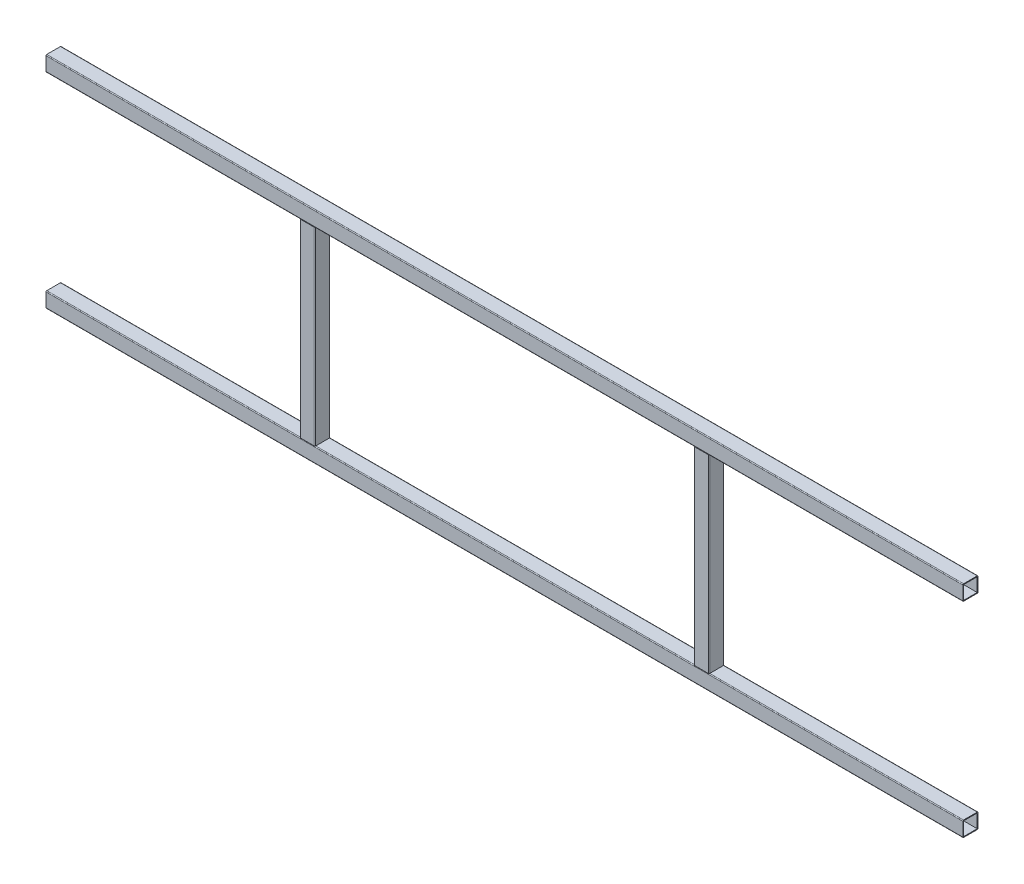
from build123d import *

# Parameters (mm, degrees)
F_8639_82_80_X_80_X_4_0_1_DEPTH   = 4840
F_8639_82_80_X_80_X_4_0_1_2_DEPTH = 4840
F_8639_82_80_X_80_X_4_0_1_3_DEPTH = 1082
F_8639_82_80_X_80_X_4_0_1_4_DEPTH = 1082


with BuildPart() as part:
    # Sketch1 → Квадратная труба гост 8639-82 _80 X 80 X 4.0(1) (new body)
    with BuildSketch(Plane.YZ):
        with BuildLine():
            Line((-35.999, -40), (35.999, -40))
            ThreePointArc((35.999, -40), (38.828134232, -38.828134232), (40, -35.999))
            Line((40, -35.999), (40, 35.999))
            ThreePointArc((40, 35.999), (38.828134232, 38.828134232), (35.999, 40))
            Line((35.999, 40), (-35.999, 40))
            ThreePointArc((-35.999, 40), (-38.828134232, 38.828134232), (-40, 35.999))
            Line((-40, 35.999), (-40, -35.999))
            ThreePointArc((-40, -35.999), (-38.828134232, -38.828134232), (-35.999, -40))
        make_face()
        with BuildLine():
            Line((-35.999, -36), (35.999, -36))
            ThreePointArc((35.999, -36), (35.999707107, -35.999707107), (36, -35.999))
            Line((36, -35.999), (36, 35.999))
            ThreePointArc((36, 35.999), (35.999707107, 35.999707107), (35.999, 36))
            Line((35.999, 36), (-35.999, 36))
            ThreePointArc((-35.999, 36), (-35.999707107, 35.999707107), (-36, 35.999))
            Line((-36, 35.999), (-36, -35.999))
            ThreePointArc((-36, -35.999), (-35.999707107, -35.999707107), (-35.999, -36))
        make_face(mode=Mode.SUBTRACT)
    extrude(amount=F_8639_82_80_X_80_X_4_0_1_DEPTH)


with BuildPart() as body_2:
    # Sketch1 on segment 2 (carried to segment 2) → 8639-82 _80 X 80 X 4.0_1 2 (new body)
    with BuildSketch(Plane(origin=(0, -1080, 0), x_dir=(0, 1, 0), z_dir=(1, 0, 0))):
        with BuildLine():
            Line((-35.999, -40), (35.999, -40))
            ThreePointArc((35.999, -40), (38.828134232, -38.828134232), (40, -35.999))
            Line((40, -35.999), (40, 35.999))
            ThreePointArc((40, 35.999), (38.828134232, 38.828134232), (35.999, 40))
            Line((35.999, 40), (-35.999, 40))
            ThreePointArc((-35.999, 40), (-38.828134232, 38.828134232), (-40, 35.999))
            Line((-40, 35.999), (-40, -35.999))
            ThreePointArc((-40, -35.999), (-38.828134232, -38.828134232), (-35.999, -40))
        make_face()
        with BuildLine():
            Line((-35.999, -36), (35.999, -36))
            ThreePointArc((35.999, -36), (35.999707107, -35.999707107), (36, -35.999))
            Line((36, -35.999), (36, 35.999))
            ThreePointArc((36, 35.999), (35.999707107, 35.999707107), (35.999, 36))
            Line((35.999, 36), (-35.999, 36))
            ThreePointArc((-35.999, 36), (-35.999707107, 35.999707107), (-36, 35.999))
            Line((-36, 35.999), (-36, -35.999))
            ThreePointArc((-36, -35.999), (-35.999707107, -35.999707107), (-35.999, -36))
        make_face(mode=Mode.SUBTRACT)
    extrude(amount=F_8639_82_80_X_80_X_4_0_1_2_DEPTH)


with BuildPart() as body_3:
    # Sketch1 on segment 3 (carried to segment 3) → 8639-82 _80 X 80 X 4.0_1 3 (new body)
    with BuildSketch(Plane(origin=(1380, 1, 0), x_dir=(1, 0, 0), z_dir=(0, -1, 0))):
        with BuildLine():
            Line((-35.999, -40), (35.999, -40))
            ThreePointArc((35.999, -40), (38.828134232, -38.828134232), (40, -35.999))
            Line((40, -35.999), (40, 35.999))
            ThreePointArc((40, 35.999), (38.828134232, 38.828134232), (35.999, 40))
            Line((35.999, 40), (-35.999, 40))
            ThreePointArc((-35.999, 40), (-38.828134232, 38.828134232), (-40, 35.999))
            Line((-40, 35.999), (-40, -35.999))
            ThreePointArc((-40, -35.999), (-38.828134232, -38.828134232), (-35.999, -40))
        make_face()
        with BuildLine():
            Line((-35.999, -36), (35.999, -36))
            ThreePointArc((35.999, -36), (35.999707107, -35.999707107), (36, -35.999))
            Line((36, -35.999), (36, 35.999))
            ThreePointArc((36, 35.999), (35.999707107, 35.999707107), (35.999, 36))
            Line((35.999, 36), (-35.999, 36))
            ThreePointArc((-35.999, 36), (-35.999707107, 35.999707107), (-36, 35.999))
            Line((-36, 35.999), (-36, -35.999))
            ThreePointArc((-36, -35.999), (-35.999707107, -35.999707107), (-35.999, -36))
        make_face(mode=Mode.SUBTRACT)
    extrude(amount=F_8639_82_80_X_80_X_4_0_1_3_DEPTH)

    # 8639-82 _80 X 80 X 4.0_1 3 end butt 1
    split(bisect_by=Plane(origin=(1380, -40, 0), x_dir=(1, 0, 0), z_dir=(0, -1, 0)), keep=Keep.TOP)

    # 8639-82 _80 X 80 X 4.0_1 3 end butt 2
    split(bisect_by=Plane(origin=(1380, -1040, 0), x_dir=(-1, 0, 0), z_dir=(0, 1, 0)), keep=Keep.TOP)


with BuildPart() as body_4:
    # Sketch1 on segment 4 (carried to segment 4) → 8639-82 _80 X 80 X 4.0_1 4 (new body)
    with BuildSketch(Plane(origin=(3460, 1, 0), x_dir=(1, 0, 0), z_dir=(0, -1, 0))):
        with BuildLine():
            Line((-35.999, -40), (35.999, -40))
            ThreePointArc((35.999, -40), (38.828134232, -38.828134232), (40, -35.999))
            Line((40, -35.999), (40, 35.999))
            ThreePointArc((40, 35.999), (38.828134232, 38.828134232), (35.999, 40))
            Line((35.999, 40), (-35.999, 40))
            ThreePointArc((-35.999, 40), (-38.828134232, 38.828134232), (-40, 35.999))
            Line((-40, 35.999), (-40, -35.999))
            ThreePointArc((-40, -35.999), (-38.828134232, -38.828134232), (-35.999, -40))
        make_face()
        with BuildLine():
            Line((-35.999, -36), (35.999, -36))
            ThreePointArc((35.999, -36), (35.999707107, -35.999707107), (36, -35.999))
            Line((36, -35.999), (36, 35.999))
            ThreePointArc((36, 35.999), (35.999707107, 35.999707107), (35.999, 36))
            Line((35.999, 36), (-35.999, 36))
            ThreePointArc((-35.999, 36), (-35.999707107, 35.999707107), (-36, 35.999))
            Line((-36, 35.999), (-36, -35.999))
            ThreePointArc((-36, -35.999), (-35.999707107, -35.999707107), (-35.999, -36))
        make_face(mode=Mode.SUBTRACT)
    extrude(amount=F_8639_82_80_X_80_X_4_0_1_4_DEPTH)

    # 8639-82 _80 X 80 X 4.0_1 4 end butt 1
    split(bisect_by=Plane(origin=(3460, -40, 0), x_dir=(1, 0, 0), z_dir=(0, -1, 0)), keep=Keep.TOP)

    # 8639-82 _80 X 80 X 4.0_1 4 end butt 2
    split(bisect_by=Plane(origin=(3460, -1040, 0), x_dir=(-1, 0, 0), z_dir=(0, 1, 0)), keep=Keep.TOP)


solid = Compound([part.part, body_2.part, body_3.part, body_4.part])
